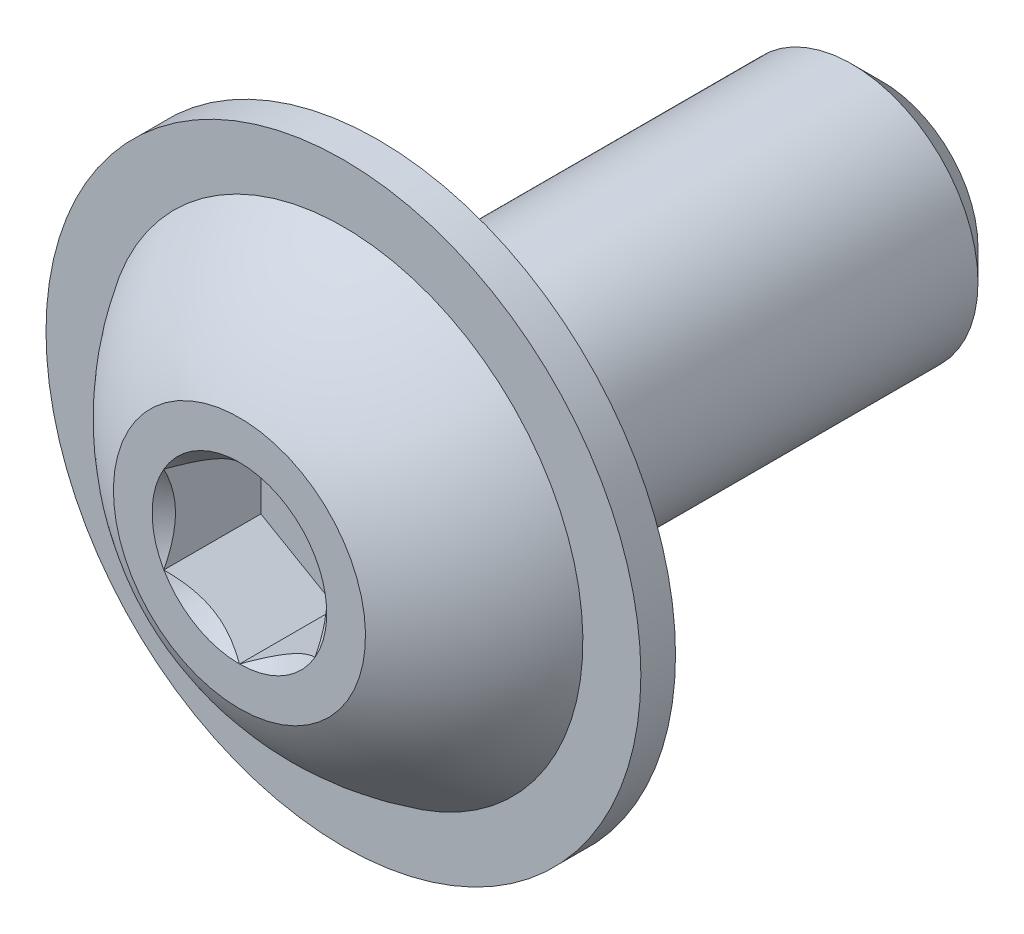
from build123d import *

# Parameters (mm, degrees)
SKETCH13_W         = 10
SKETCH13_H         = 2.5
CHAMFER1_SIZE      = 0.6
CUT_EXTRUDE2_DEPTH = 1.925


with BuildPart() as part:
    # Sketch13 → Revolve1 (revolve)
    with BuildSketch(Plane(origin=(0, 0, 0), x_dir=(0, 0, -1), z_dir=(1, 0, 0))):
        with Locations((1.375, 1.25)):
            Rectangle(SKETCH13_W, SKETCH13_H)
    revolve(axis=Axis((0, 0, 6.375), (0, 0, -1)))

    # Chamfer1
    chamfer1_edges = [part.edges().sort_by_distance(p)[0] for p in [
        (0, -2.5, -6.375),
    ]]
    chamfer(chamfer1_edges, length=CHAMFER1_SIZE)

    # Sketch7 → Revolve2 (revolve)
    with BuildSketch(Plane(origin=(0, 0, 0), x_dir=(0, 0, -1), z_dir=(1, 0, 0))):
        with BuildLine():
            Line((-3.625, 4.75), (-3.625, 0))
            Line((-3.625, 0), (-6.375, 0))
            Line((-6.375, 0), (-6.375, 2.5))
            ThreePointArc((-6.375, 2.5), (-5.500658638, 3.768832918), (-4.3125, 4.75))
            Line((-4.3125, 4.75), (-4.3125, 5.9))
            Line((-4.3125, 5.9), (-3.625, 5.9))
            Line((-3.625, 5.9), (-3.625, 4.75))
        make_face()
    revolve(axis=Axis((0, 0, 6.375), (0, 0, -1)))

    # Sketch5 → Cut-Extrude2 (cut)
    with BuildSketch(Plane.XY.offset(6.375)):
        Polygon((1.5, -0.866025404), (1.5, 0.866025404), (0, 1.732050808), (-1.5, 0.866025404), (-1.5, -0.866025404), (0, -1.732050808), align=None)
    extrude(amount=-CUT_EXTRUDE2_DEPTH, mode=Mode.SUBTRACT)

    # Cut-Extrude3 cone 1 section (through the dimple's axis) → Cut-Extrude3 (revolve, cut)
    with BuildSketch(Plane(origin=(0, 0, 6.375), x_dir=(0, -1, 0), z_dir=(1, 0, 0))):
        Polygon((0, 0), (1.732050808, 0), (0, 1.732050808), align=None)
    revolve(axis=Axis((0, 0, 6.375), (0, 0, -1)), mode=Mode.SUBTRACT)


solid = part.part
